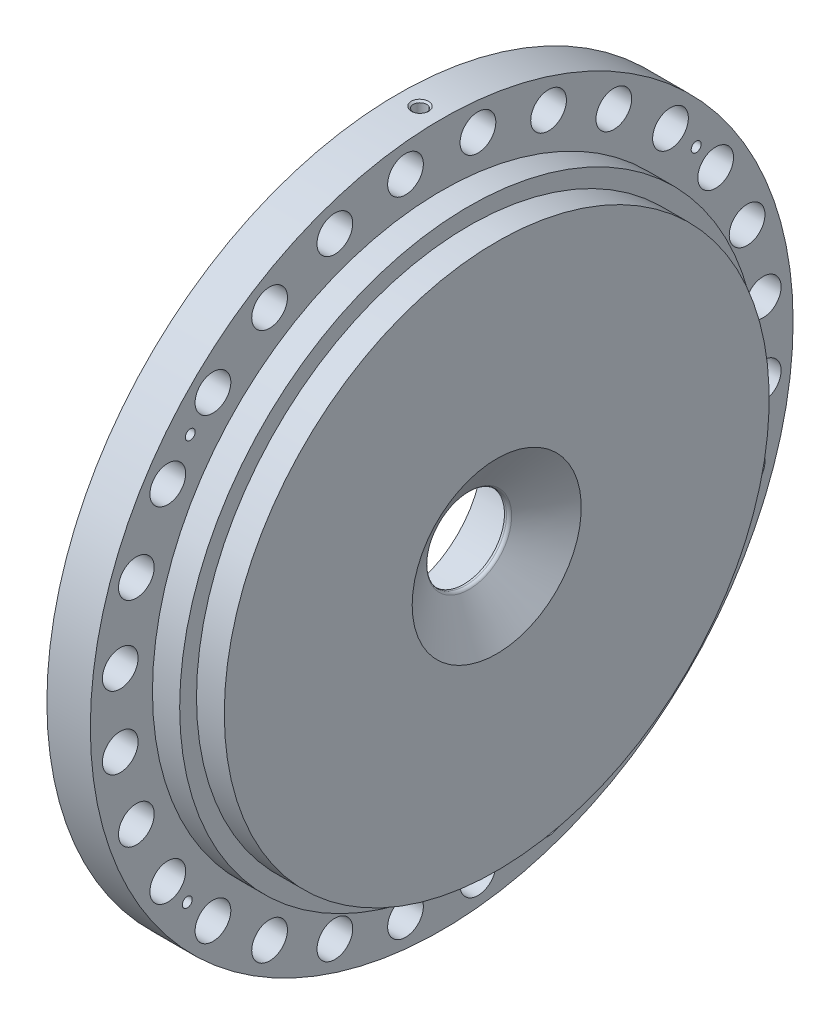
from build123d import *

# Parameters (mm, degrees)
SKETCH4_R                         = 14.2875
CUT_EXTRUDE1_DEPTH                = 406.190469782
CIRPATTERN2_COUNT                 = 28
CIRPATTERN3_COUNT                 = 12
CIRPATTERN4_COUNT                 = 4
CIRPATTERN5_COUNT                 = 56
F_1_2_13_TAPPED_HOLE4_D           = 10.71626
F_1_2_13_TAPPED_HOLE4_DEPTH       = 35.052
F_1_2_13_TAPPED_HOLE4_CSINK_D     = 13.97
F_1_2_13_TAPPED_HOLE4_CSINK_ANGLE = 100
F_1_2_13_TAPPED_HOLE4_TIP         = 3.219489309


with BuildPart() as part:
    # Sketch1 → Revolve1 (revolve)
    with BuildSketch(Plane.XY, mode=Mode.PRIVATE) as revolve1_sk:
        with BuildLine():
            Line((-5.9944, 67.5132), (-5.9944, 180.9496))
            Line((-5.9944, 180.9496), (0, 180.9496))
            Line((0, 180.9496), (0, 228.9937))
            Line((0, 228.9937), (-5.9944, 228.9937))
            Line((-5.9944, 228.9937), (-5.9944, 281.051))
            Line((-5.9944, 281.051), (28.7528, 281.051))
            Line((28.7528, 281.051), (28.7528, 231.3686))
            Line((28.7528, 231.3686), (50.5206, 231.3686))
            Line((50.5206, 231.3686), (50.5206, 217.9066))
            Line((50.5206, 217.9066), (72.7456, 217.9066))
            Line((72.7456, 217.9066), (72.7456, 67.6275))
            Line((72.7456, 67.6275), (50.673623931, 33.9957528))
            ThreePointArc((50.673623931, 33.9957528), (49.527461337, 32.943911593), (48.019213158, 32.5628))
            Line((48.019213158, 32.5628), (46.4058, 32.5628))
            Line((46.4058, 32.5628), (46.4058, 67.5132))
            Line((46.4058, 67.5132), (-5.9944, 67.5132))
        make_face()
    revolve(revolve1_sk.sketch.rotate(Axis((0, 0, 0), (1, 0, 0)), 90), axis=Axis((0, 0, 0), (1, 0, 0)))

    # Sketch4 → Cut-Extrude1 (cut, through all)
    with BuildSketch(Plane.ZY.offset(5.9944)):
        with Locations((28.972111579, 257.135466548)):
            Circle(SKETCH4_R)
    cut_extrude1 = extrude(amount=-CUT_EXTRUDE1_DEPTH, mode=Mode.SUBTRACT)

    # CirPattern2: Cut-Extrude1 ×28 about axis
    cirpattern2_axis = Axis((0, 0, 0), (1, 0, 0))
    for i in range(1, CIRPATTERN2_COUNT):
        add(cut_extrude1.rotate(cirpattern2_axis, i * 360 / CIRPATTERN2_COUNT), mode=Mode.SUBTRACT)

    # Sketch8 → 3/4-10 Tapped Hole1 (revolve, cut)
    with BuildSketch(Plane(origin=(0, 199.3429424, 53.413780433), x_dir=(0, 0, 1), z_dir=(0, 1, 0))):
        Polygon((0, 0), (0, 30.407416175), (8.33374, 25.4), (8.33374, 1.82626), (10.16, 0), align=None)
    f_3_4_10_tapped_hole1 = revolve(axis=Axis((-6.35, 199.3429424, 53.413780433), (1, 0, 0)), mode=Mode.SUBTRACT)

    # CirPattern3: 3/4-10 Tapped Hole1 ×12 about axis
    cirpattern3_axis = Axis((0, 0, 0), (1, 0, 0))
    for i in range(1, CIRPATTERN3_COUNT):
        add(f_3_4_10_tapped_hole1.rotate(cirpattern3_axis, i * 360 / CIRPATTERN3_COUNT), mode=Mode.SUBTRACT)

    # Sketch10 → 7/8-9 Tapped Hole1 (revolve, cut)
    with BuildSketch(Plane(origin=(-5.9944, 67.172315786, 67.172315786), x_dir=(0, 0, 1), z_dir=(0, 1, 0))):
        Polygon((0, 0), (0, 31.242239902), (9.72312, 25.4), (9.72312, 2.02438), (11.7475, 0), align=None)
    f_7_8_9_tapped_hole1 = revolve(axis=Axis((-12.3444, 67.172315786, 67.172315786), (1, 0, 0)), mode=Mode.SUBTRACT)

    # CirPattern4: 7/8-9 Tapped Hole1 ×4 about axis
    cirpattern4_axis = Axis((0, 0, 0), (1, 0, 0))
    for i in range(1, CIRPATTERN4_COUNT):
        add(f_7_8_9_tapped_hole1.rotate(cirpattern4_axis, i * 360 / CIRPATTERN4_COUNT), mode=Mode.SUBTRACT)

    # Sketch21 → Tap Drill for 3/8-16 Tap1 (revolve, cut)
    with BuildSketch(Plane(origin=(-5.9944, 162.844517689, 201.096231852), x_dir=(0, 0, 1), z_dir=(0, 1, 0))):
        Polygon((0, 0), (0, 43.024665582), (3.96875, 40.64), (3.96875, 0.635), (4.60375, 0), align=None)
    tap_drill_for_3_8_16_tap1 = revolve(axis=Axis((-12.3444, 162.844517689, 201.096231852), (1, 0, 0)), mode=Mode.SUBTRACT)

    # CirPattern5: Tap Drill for 3/8-16 Tap1 ×56 about axis, 52 skipped
    cirpattern5_axis = Axis((0, 0, 0), (-1, 0, 0))
    add([tap_drill_for_3_8_16_tap1.rotate(cirpattern5_axis, i * 360 / CIRPATTERN5_COUNT) for i in range(1, CIRPATTERN5_COUNT) if i not in (1, 2, 3, 4, 5, 6, 7, 8, 9, 10, 11, 12, 13, 14, 15, 17, 18, 19, 20, 21, 22, 23, 24, 25, 26, 27, 29, 30, 31, 32, 33, 34, 35, 36, 37, 38, 39, 40, 41, 42, 43, 45, 46, 47, 48, 49, 50, 51, 52, 53, 54, 55)], mode=Mode.SUBTRACT)

    # 1/2-13 Tapped Hole4
    with Locations(Plane(origin=(11.3792, 281.051, 0), x_dir=(0, 0, 1), z_dir=(0, 1, 0))):
        with Locations((0, 0)):
            CounterSinkHole(F_1_2_13_TAPPED_HOLE4_D / 2, F_1_2_13_TAPPED_HOLE4_CSINK_D / 2, depth=F_1_2_13_TAPPED_HOLE4_DEPTH, counter_sink_angle=F_1_2_13_TAPPED_HOLE4_CSINK_ANGLE)
            with Locations((0, 0, -(F_1_2_13_TAPPED_HOLE4_DEPTH + F_1_2_13_TAPPED_HOLE4_TIP / 2))):  # 118° drill point
                Cone(0, F_1_2_13_TAPPED_HOLE4_D / 2, F_1_2_13_TAPPED_HOLE4_TIP, mode=Mode.SUBTRACT)


solid = part.part
